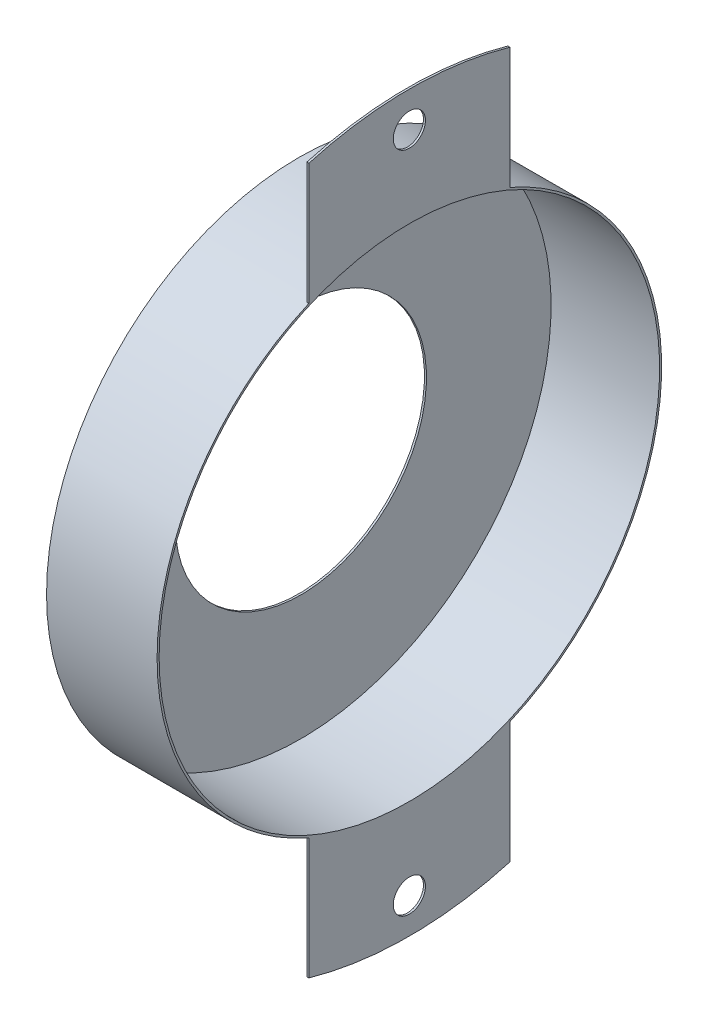
from build123d import *

# Parameters (mm, degrees)
CUT_EXTRUDE2_DEPTH = 53.77783625727755
SKETCH4_R          = 1.5999999999999994
CUT_EXTRUDE3_DEPTH = 46.594955861366955
SKETCH2_R          = 12.5
CUT_EXTRUDE4_DEPTH = 10


with BuildPart() as part:
    # Sketch1 → Revolve1 (revolve)
    with BuildSketch(Plane.XY, mode=Mode.PRIVATE) as revolve1_sk:
        Polygon((0.1, 0), (0.1, 24.900000000000002), (10.9, 24.900000000000002), (10.9, 36.50000000000001), (10.700000000000001, 36.50000000000001), (10.700000000000001, 25.1), (-0.1, 25.1), (-0.1, 0), align=None)
    revolve(revolve1_sk.sketch.rotate(Axis((0, 0, 0), (1, 0, 0)), 90), axis=Axis((0, 0, 0), (1, 0, 0)))

    # Sketch3 → Cut-Extrude2 (cut, through all)
    with BuildSketch(Plane.ZY.offset(0.1)):
        with BuildLine():
            Line((-10, 23.02194605153985), (-10, 35.10341863693621))
            ThreePointArc((-10, 35.10341863693621), (-36.50000000000001, 4.47e-15), (-10.000000000000007, -35.103418636936205))
            Line((-9.999999999999996, -35.10341863693621), (-9.999999999999996, -23.021946051539842))
            ThreePointArc((-9.999999999999691, -23.02194605153974), (-25.1, 3.07e-15), (-9.999999999999675, 23.021946051539746))
        make_face()
        with BuildLine():
            ThreePointArc((36.50000000000001, 0), (29.131168874592042, 21.991475621249254), (9.999999999999995, 35.10341863693621))
            Line((10, 35.10341863693621), (10, 23.021946051539338))
            ThreePointArc((10.000000000000362, 23.021946051539448), (20.98821097664126, 13.766081504916185), (25.1, 0))
            ThreePointArc((25.1, -6.15e-15), (20.98821097664126, -13.766081504916182), (10.000000000000357, -23.02194605153945))
            Line((9.999999999999996, -23.021946051539338), (9.999999999999996, -35.10341863693621))
            ThreePointArc((9.999999999999995, -35.10341863693621), (29.13116887459203, -21.991475621249272), (36.50000000000001, -8.94e-15))
        make_face()
    extrude(amount=-CUT_EXTRUDE2_DEPTH, mode=Mode.SUBTRACT)

    # Sketch4 → Cut-Extrude3 (cut, through all)
    with BuildSketch(Plane.ZY.offset(-10.700000000000001)):
        with Locations((0, 33)):
            Circle(SKETCH4_R)
        with Locations((0, -33)):
            Circle(SKETCH4_R)
    extrude(amount=-CUT_EXTRUDE3_DEPTH, mode=Mode.SUBTRACT)

    # Sketch2 → Cut-Extrude4 (cut)
    with BuildSketch(Plane.ZY.offset(0.1)):
        Circle(SKETCH2_R)
    extrude(amount=-CUT_EXTRUDE4_DEPTH, mode=Mode.SUBTRACT)


solid = part.part
